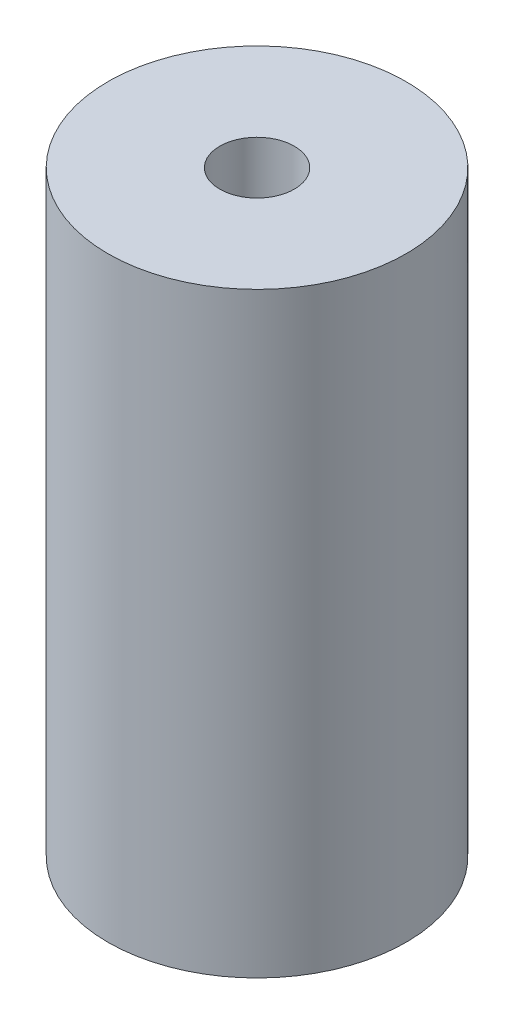
from build123d import *

# Parameters (mm, degrees)
SKETCH_1_R          = 10
EXTRUDE_1_DEPTH     = 40
SKETCH_3_R          = 2.5
CUT_EXTRUDE_8_DEPTH = 20
SKETCH_4_R          = 2.5
CUT_EXTRUDE_9_DEPTH = 20


with BuildPart() as part:
    # 草图1 → 凸台-拉伸1 (new body)
    with BuildSketch(Plane(origin=(0, 0, 0), x_dir=(1, 0, 0), z_dir=(0, 1, 0))):
        with Locations(Location((0, 0, 0), (0, 0, 270))):
            Circle(SKETCH_1_R)
    extrude(amount=EXTRUDE_1_DEPTH)

    # 草图3 → 切除-拉伸8 (cut)
    with BuildSketch(Plane(origin=(0, 40, 0), x_dir=(1, 0, 0), z_dir=(0, 1, 0))):
        with Locations(Location((0, 0, 0), (0, 0, 270))):
            Circle(SKETCH_3_R)
    extrude(amount=-CUT_EXTRUDE_8_DEPTH, mode=Mode.SUBTRACT)

    # 草图4 → 切除-拉伸9 (cut)
    with BuildSketch(Plane.XY):
        with Locations((0, 20)):
            Circle(SKETCH_4_R)
    extrude(amount=-CUT_EXTRUDE_9_DEPTH, mode=Mode.SUBTRACT)


solid = part.part
